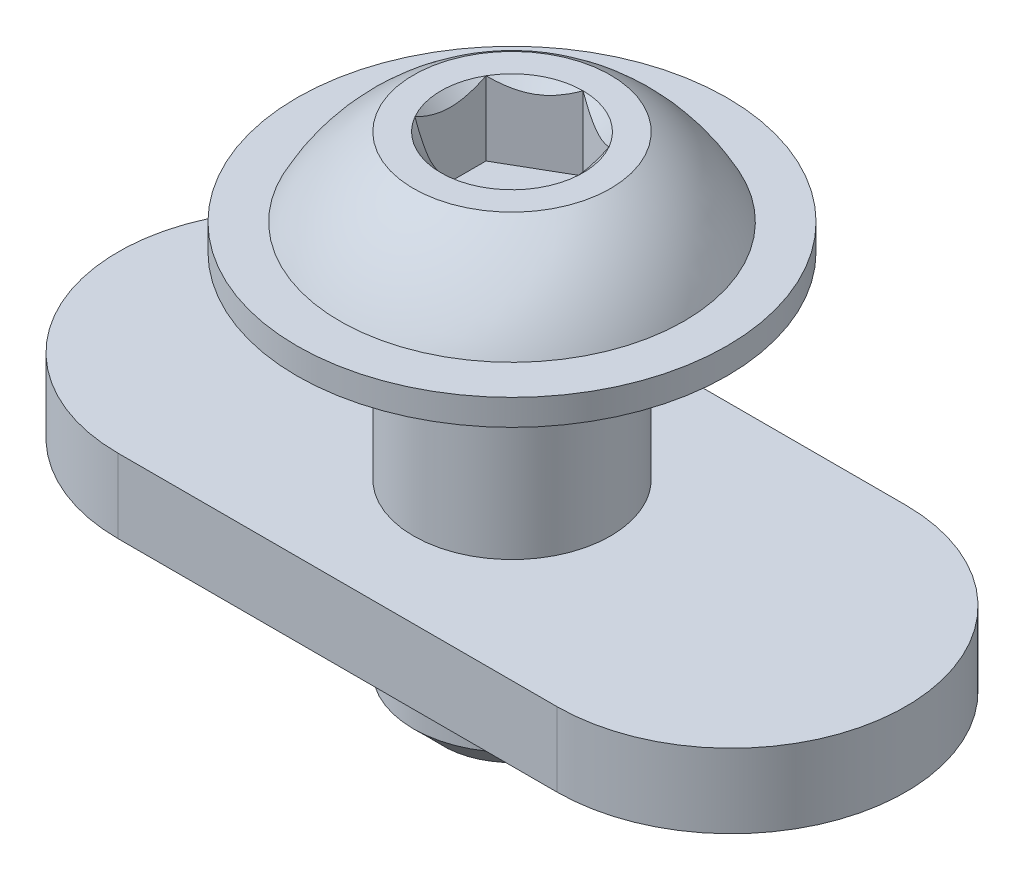
from build123d import *

# Parameters (mm, degrees)
SKETCH1_R           = 3.175
BOSS_EXTRUDE1_DEPTH = 12.7
SKETCH4_OUTSIDE_W   = 14
SKETCH4_OUTSIDE_H   = 14
SKETCH4_OUTSIDE_R   = 2.21262927
CUT_EXTRUDE1_DEPTH  = 1.27
CUT_EXTRUDE1_DRAFT  = -45
CUT_EXTRUDE2_DEPTH  = 2.38125
BOSS_EXTRUDE2_START = -6.35
SKETCH8_R           = 3.175
BOSS_EXTRUDE2_DEPTH = 2.3876
SKETCH9_R           = 3.5687
SKETCH9_R_2         = 3.175
BOSS_EXTRUDE3_DEPTH = 0.762


with BuildPart() as part:
    # Sketch1 → Boss-Extrude1 (new body)
    with BuildSketch(Plane(origin=(0, 0, 0), x_dir=(1, 0, 0), z_dir=(0, 1, 0))):
        Circle(SKETCH1_R)
    extrude(amount=-BOSS_EXTRUDE1_DEPTH)


with BuildPart() as cut_extrude1_tool:
    # Sketch4 outside → Cut-Extrude1 (with draft: the straight prism first)
    with BuildSketch(Plane.XZ.offset(12.7)):
        Rectangle(SKETCH4_OUTSIDE_W, SKETCH4_OUTSIDE_H)
        Circle(SKETCH4_OUTSIDE_R, mode=Mode.SUBTRACT)
    extrude(amount=-CUT_EXTRUDE1_DEPTH)
    # Cut-Extrude1: the draft: its side faces are tilted about the plane it starts from
    cut_extrude1_sides = [cut_extrude1_tool.faces().sort_by_distance(p)[0] for p in [
        (0, -12.065, -7),
        (7, -12.065, 0),
        (0, -12.065, 7),
        (-7, -12.065, 0),
        (-2.21262927, -12.065, 0),
    ]]
    draft(cut_extrude1_sides, Plane.XZ.offset(12.7), CUT_EXTRUDE1_DRAFT)


with BuildPart() as part_1:
    add(part.part)

    # Cut-Extrude1: cut by cut_extrude1_tool
    add(cut_extrude1_tool.part, mode=Mode.SUBTRACT)

    # Sketch5 → Revolve1 (revolve)
    with BuildSketch(Plane.XY):
        with BuildLine():
            Line((0, 0), (0, 3.3528))
            Line((0, 3.3528), (-3.175, 3.3528))
            ThreePointArc((-3.175, 3.3528), (-4.540019085, 2.263204136), (-5.5499, 0.8382))
            Line((-5.5499, 0.8382), (-6.9342, 0.8382))
            Line((-6.9342, 0.8382), (-6.9342, 0))
            Line((-6.9342, 0), (0, 0))
        make_face()
    revolve(axis=Axis((0, 0, 0), (0, 1, 0)))

    # Sketch6 → Cut-Extrude2 (cut)
    with BuildSketch(Plane(origin=(0, 3.3528, 0), x_dir=(1, 0, 0), z_dir=(0, 1, 0))):
        Polygon((0, 2.291358881), (-1.984375, 1.14567944), (-1.984375, -1.14567944), (0, -2.291358881), (1.984375, -1.14567944), (1.984375, 1.14567944), align=None)
    extrude(amount=-CUT_EXTRUDE2_DEPTH, mode=Mode.SUBTRACT)

    # Cut-Extrude3 cone 1 section (through the dimple's axis) → Cut-Extrude3 (revolve, cut)
    with BuildSketch(Plane(origin=(0, 3.3528, 0), x_dir=(0, 0, 1), z_dir=(1, 0, 0))):
        Polygon((0, 0), (2.291358881, 0), (0, 2.291358881), align=None)
    revolve(axis=Axis((0, 3.3528, 0), (0, -1, 0)), mode=Mode.SUBTRACT)


with BuildPart() as body_2:
    # Sketch8 → Boss-Extrude2 (new body)
    with BuildSketch(Plane(origin=(0, 0, 0), x_dir=(1, 0, 0), z_dir=(0, 1, 0)).offset(BOSS_EXTRUDE2_START)):
        with BuildLine():
            Line((-7.0739, 5.6261), (7.0739, 5.6261))
            ThreePointArc((7.0739, 5.6261), (12.7, 0), (7.0739, -5.6261))
            Line((7.0739, -5.6261), (-7.0739, -5.6261))
            ThreePointArc((-7.0739, -5.6261), (-12.7, 0), (-7.0739, 5.6261))
        make_face()
        Circle(SKETCH8_R, mode=Mode.SUBTRACT)
    extrude(amount=-BOSS_EXTRUDE2_DEPTH)

    # Sketch9 → Boss-Extrude3 (add)
    with BuildSketch(Plane.XZ.offset(8.7376)):
        Circle(SKETCH9_R)
        Circle(SKETCH9_R_2, mode=Mode.SUBTRACT)
    extrude(amount=BOSS_EXTRUDE3_DEPTH)


solid = Compound([part_1.part, body_2.part])
